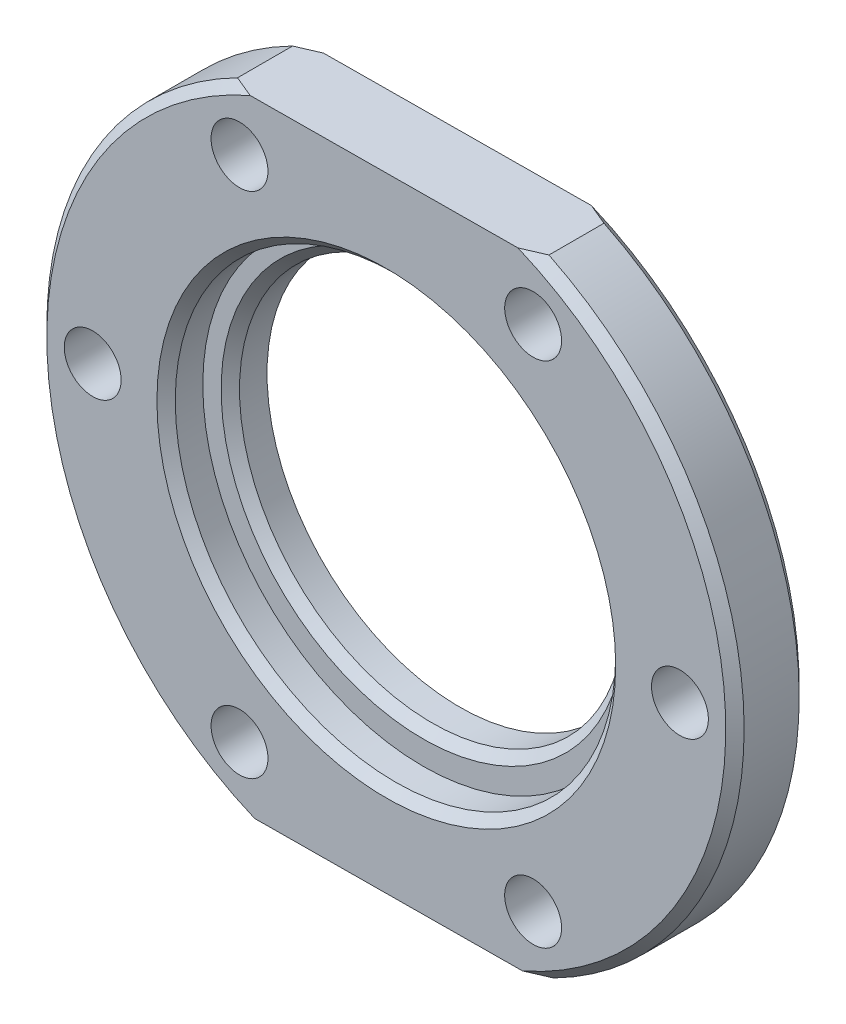
from build123d import *

# Parameters (mm, degrees)
SKETCH2_R           = 10.5
SKETCH2_R_2         = 1.55
BOSS_EXTRUDE1_DEPTH = 4
SKETCH3_R           = 12
CUT_EXTRUDE1_DEPTH  = 2
CHAMFER1_SIZE       = 0.5


with BuildPart() as part:
    # Sketch2 → Boss-Extrude1 (new body)
    with BuildSketch(Plane.XY):
        with BuildLine():
            Line((-8.606779144, 16.938812023), (8.36334863, 17.060316518))
            ThreePointArc((8.36334863, 17.060316518), (18.999513009, 0.136034699), (8.606779144, -16.938812023))
            Line((8.606779144, -16.938812023), (-8.36334863, -17.060316518))
            ThreePointArc((-8.36334863, -17.060316518), (-18.999513009, -0.136034699), (-8.606779144, 16.938812023))
        make_face()
        with Locations((0, 0.289780582)):
            Circle(SKETCH2_R, mode=Mode.SUBTRACT)
        with Locations((-16, 0)):
            Circle(SKETCH2_R_2, mode=Mode.SUBTRACT)
        with Locations((-7.9995, 13.857272486)):
            Circle(SKETCH2_R_2, mode=Mode.SUBTRACT)
        with Locations((8.0015, 13.857272486)):
            Circle(SKETCH2_R_2, mode=Mode.SUBTRACT)
        with Locations((16.002, 0)):
            Circle(SKETCH2_R_2, mode=Mode.SUBTRACT)
        with Locations((8.0015, -13.857272486)):
            Circle(SKETCH2_R_2, mode=Mode.SUBTRACT)
        with Locations((-7.9995, -13.857272486)):
            Circle(SKETCH2_R_2, mode=Mode.SUBTRACT)
    extrude(amount=BOSS_EXTRUDE1_DEPTH)

    # Sketch3 → Cut-Extrude1 (cut)
    with BuildSketch(Plane.XY.offset(4)):
        Circle(SKETCH3_R)
    extrude(amount=-CUT_EXTRUDE1_DEPTH, mode=Mode.SUBTRACT)

    # Chamfer1
    chamfer1_edges = [part.edges().sort_by_distance(p)[0] for p in [
        (18.999513009, 0.136034699, 4),
        (-10.5, 0.289780582, 2),
        (-12, 0, 4),
        (-18.999513009, -0.136034699, 4),
        (18.999513009, 0.136034699, 0),
        (-18.999513009, -0.136034699, 0),
    ]]
    chamfer(chamfer1_edges, length=CHAMFER1_SIZE)


solid = part.part
